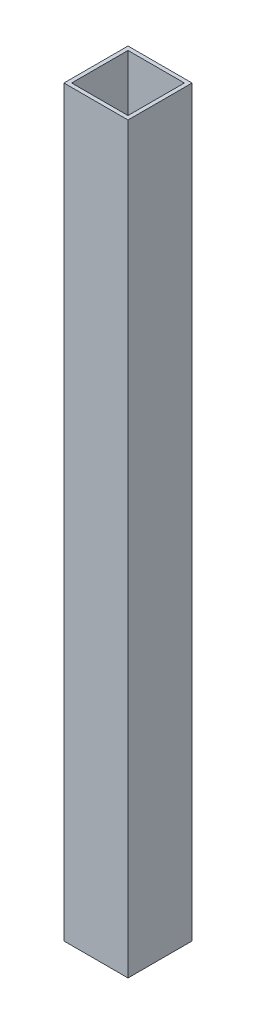
from build123d import *

# Parameters (mm, degrees)
SKETCH1_W           = 12.5
SKETCH1_H           = 12.5
SKETCH1_W_2         = 11
SKETCH1_H_2         = 11
BOSS_EXTRUDE3_DEPTH = 145


with BuildPart() as part:
    # Sketch1 → Boss-Extrude3 (new body)
    with BuildSketch(Plane(origin=(0, 0, 0), x_dir=(1, 0, 0), z_dir=(0, 1, 0))):
        with Locations((-20.377754415, -4.412827368)):
            Rectangle(SKETCH1_W, SKETCH1_H)
        with Locations((-20.377754415, -4.412827368)):
            Rectangle(SKETCH1_W_2, SKETCH1_H_2, mode=Mode.SUBTRACT)
    extrude(amount=BOSS_EXTRUDE3_DEPTH)


solid = part.part
